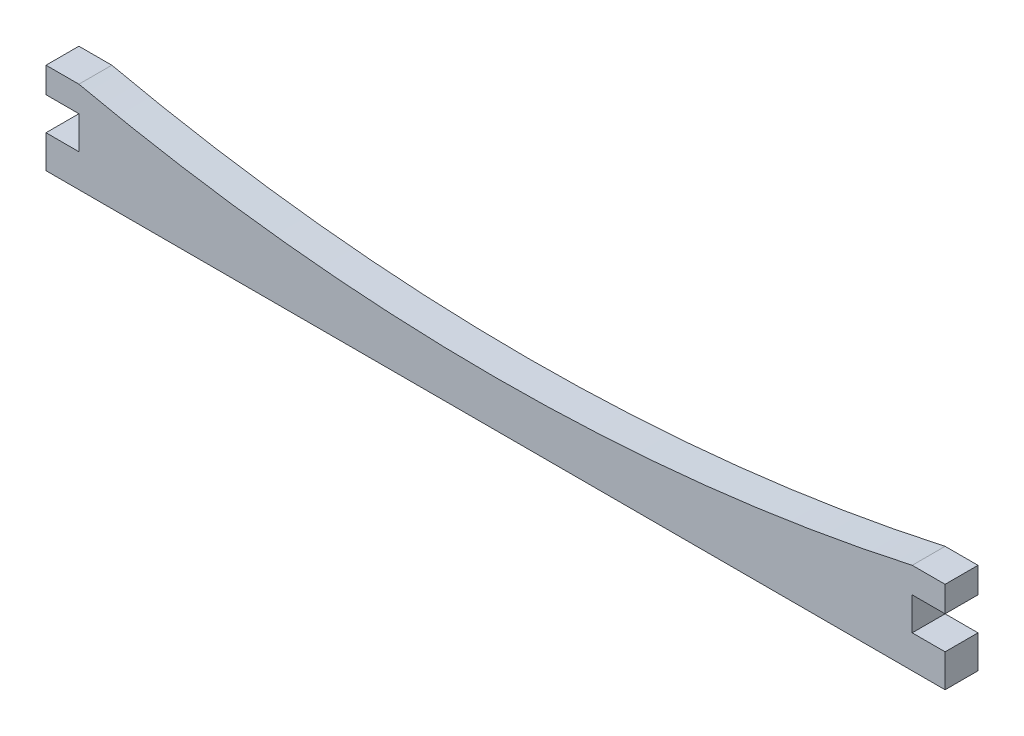
from build123d import *

# Parameters (mm, degrees)
BOSS_EXTRUDE2_DEPTH = 9
SKETCH2_W           = 9
SKETCH2_H           = 9
CUT_EXTRUDE1_DEPTH  = 126.837196409


with BuildPart() as part:
    # Sketch1 → Boss-Extrude2 (new body)
    with BuildSketch(Plane.XY):
        with BuildLine():
            Line((-123, 25), (-123, 0))
            Line((-123, 0), (123, 0))
            Line((123, 0), (123, 25))
            Line((123, 25), (114, 25))
            ThreePointArc((114, 25), (0, 12.5), (-114, 25))
            Line((-114, 25), (-123, 25))
        make_face()
    extrude(amount=BOSS_EXTRUDE2_DEPTH)

    # Sketch2 → Cut-Extrude1 (cut, through all)
    with BuildSketch(Plane.XY):
        with Locations((118.5, 13.5)):
            Rectangle(SKETCH2_W, SKETCH2_H)
        with Locations((-118.5, 13.5)):
            Rectangle(SKETCH2_W, SKETCH2_H)
    extrude(amount=CUT_EXTRUDE1_DEPTH, mode=Mode.SUBTRACT)


solid = part.part
